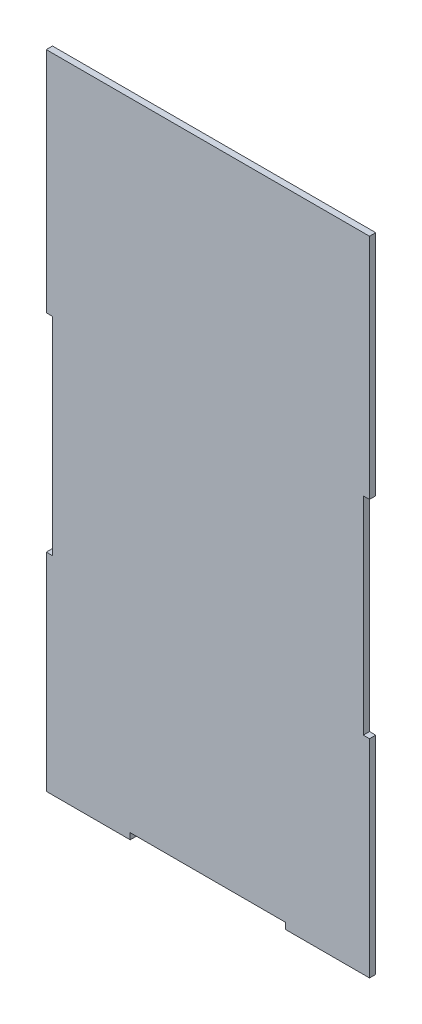
from build123d import *

# Parameters (mm, degrees)
SALIENTE_EXTRUIR1_DEPTH = 3


with BuildPart() as part:
    # Croquis1 → Saliente-Extruir1 (new body)
    with BuildSketch(Plane.XY):
        Polygon((0, 200), (0, 310), (156, 310), (156, 200), (153, 200), (153, 100), (156, 100), (156, 0), (115.5, 0), (115.5, 3), (40.5, 3), (40.5, 0), (0, 0), (0, 100), (3, 100), (3, 200), align=None)
    extrude(amount=SALIENTE_EXTRUIR1_DEPTH)


solid = part.part
